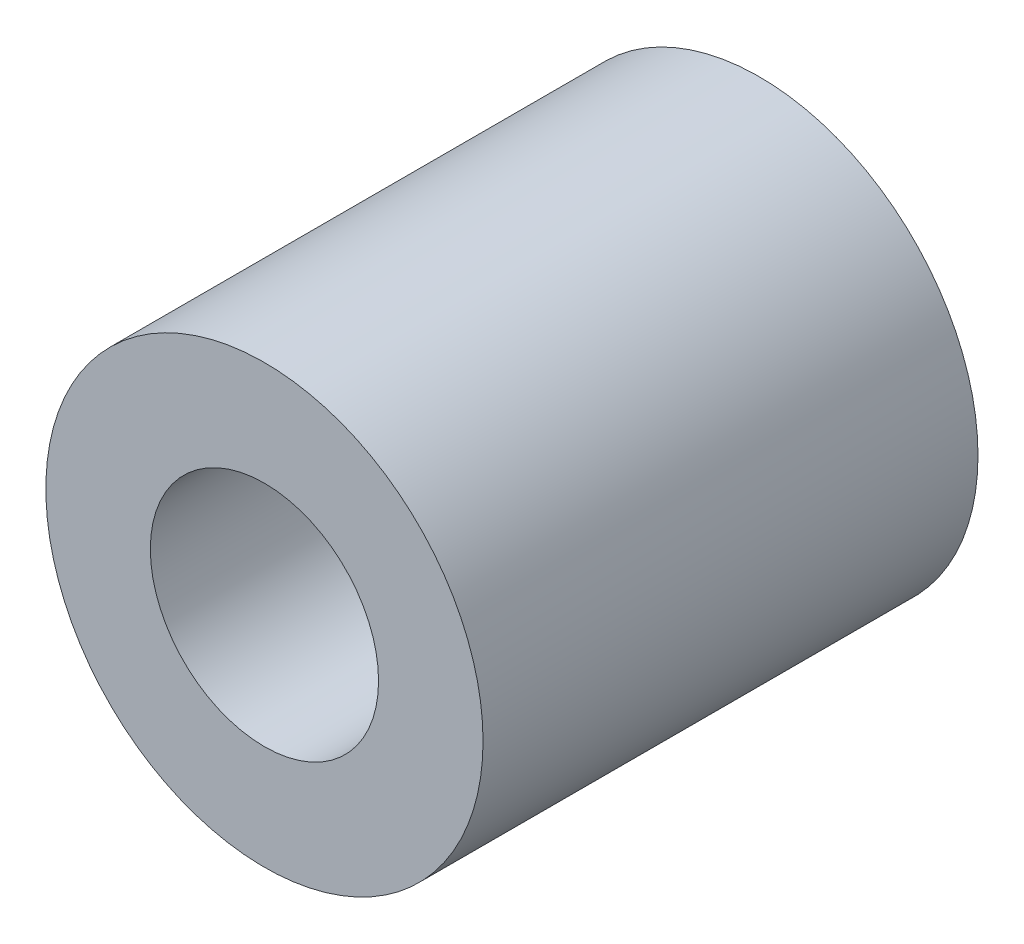
from build123d import *

# Parameters (mm, degrees)
SKETCH1_R           = 7.95
SKETCH1_R_2         = 4.15
BOSS_EXTRUDE1_DEPTH = 18


with BuildPart() as part:
    # Sketch1 → Boss-Extrude1 (new body)
    with BuildSketch(Plane.XY):
        Circle(SKETCH1_R)
        Circle(SKETCH1_R_2, mode=Mode.SUBTRACT)
    extrude(amount=BOSS_EXTRUDE1_DEPTH)


solid = part.part
